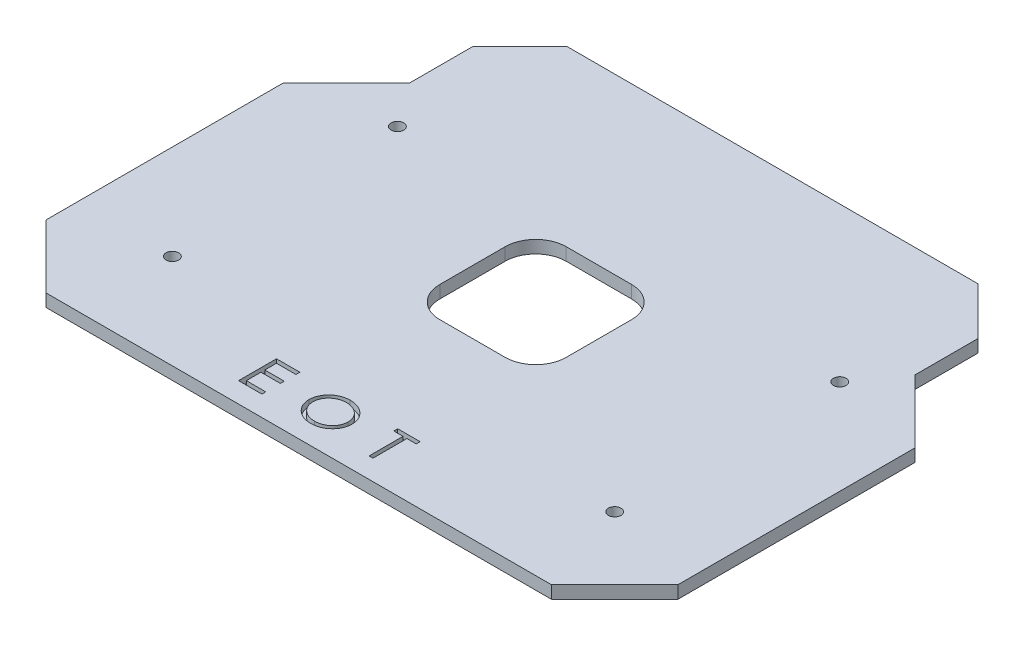
from build123d import *

# Parameters (mm, degrees)
SKETCH1_R           = 2
BOSS_EXTRUDE1_DEPTH = 4
CUT_EXTRUDE1_DEPTH  = 2


with BuildPart() as part:
    # Sketch1 → Boss-Extrude1 (new body)
    with BuildSketch(Plane(origin=(0, 0, 0), x_dir=(1, 0, 0), z_dir=(0, 1, 0))):
        Polygon((-80, 9.45742592), (-65, 24.45742592), (-25, 24.45742592), (25, 24.45742592), (65, 24.45742592), (80, 9.45742592), (80, -10.54257408), (100, -30.54257408), (100, -105.54257408), (80, -125.54257408), (-80, -125.54257408), (-100, -105.54257408), (-100, -30.54257408), (-80, -10.54257408), align=None)
        with Locations(Location((70, -24.316787178, 0), (0, 0, 270))):
            Circle(SKETCH1_R, mode=Mode.SUBTRACT)
        with Locations(Location((-70, -24.316787178, 0), (0, 0, 90))):
            Circle(SKETCH1_R, mode=Mode.SUBTRACT)
        with Locations(Location((70, -95.54257408, 0), (0, 0, 270))):
            Circle(SKETCH1_R, mode=Mode.SUBTRACT)
        with Locations(Location((-70, -95.54257408, 0), (0, 0, 90))):
            Circle(SKETCH1_R, mode=Mode.SUBTRACT)
        with BuildLine():
            Line((10.337598094, -30.54257408), (-10.337598094, -30.54257408))
            ThreePointArc((-10.337598094, -30.54257408), (-17.169948004, -33.372626076), (-20, -40.204975986))
            Line((-20, -40.204975986), (-20, -60.880172175))
            ThreePointArc((-20, -60.880172175), (-17.169948004, -67.712522085), (-10.337598094, -70.54257408))
            Line((-10.337598094, -70.54257408), (10.337598094, -70.54257408))
            ThreePointArc((10.337598094, -70.54257408), (17.169948004, -67.712522085), (20, -60.880172175))
            Line((20, -60.880172175), (20, -40.204975986))
            ThreePointArc((20, -40.204975986), (17.169948004, -33.372626076), (10.337598094, -30.54257408))
        make_face(mode=Mode.SUBTRACT)
    extrude(amount=BOSS_EXTRUDE1_DEPTH)

    # Sketch2 → Cut-Extrude1 (cut)
    # profile 1 of 3: a face of its own
    with BuildSketch(Plane(origin=(0, 4, 0), x_dir=(1, 0, 0), z_dir=(0, 1, 0))):
        Polygon((-25.472812288, -107.11733973), (-18.088196904, -107.11733973), (-18.088196904, -108.348108961), (-24.242043057, -108.348108961), (-24.242043057, -112.040416653), (-18.088196904, -112.040416653), (-18.088196904, -113.271185884), (-24.242043057, -113.271185884), (-24.242043057, -117.886570499), (-18.088196904, -117.886570499), (-18.088196904, -119.11733973), (-25.472812288, -119.11733973), align=None)
    # profile 2 of 3: a face of its own
    with BuildSketch(Plane(origin=(0, 4, 0), x_dir=(1, 0, 0), z_dir=(0, 1, 0))):
        with BuildLine():
            add(Edge.make_bspline(
                [(-2.449254596, -106.809647422), (-2.210250294, -106.815291388), (-1.741137338, -106.826369254), (-1.052600103, -106.910458186), (-0.39562656, -107.057401058), (0.234998612, -107.251617707), (0.833013231, -107.511533008), (1.401913508, -107.825392722), (1.940223039, -108.19794914), (2.443138546, -108.623167189), (2.901482907, -109.087804066), (3.30556983, -109.582626329), (3.641608313, -110.107938076), (3.925601094, -110.655428552), (4.137939972, -111.233761906), (4.293457565, -111.836588501), (4.386018721, -112.46623686), (4.398023561, -112.895080616), (4.404110789, -113.112532038)],
                knots=[0, 0, 0, 0, 1.104339174, 2.167575275, 3.19895946, 4.211974237, 5.212103104, 6.206540156, 7.210035823, 8.232212855, 9.245525355, 10.222267028, 11.178495095, 12.122427609, 13.066774007, 14.018748382, 14.995377748, 16, 16, 16, 16], degree=3))
            add(Edge.make_bspline(
                [(4.404110789, -113.112532038), (4.398050369, -113.328392066), (4.386099229, -113.754067761), (4.293053577, -114.379582401), (4.138376677, -114.979542971), (3.923642546, -115.555449046), (3.645900791, -116.106283535), (3.303525105, -116.630032235), (2.902767408, -117.129340391), (2.445660949, -117.597050461), (1.945808283, -118.023324325), (1.413543804, -118.399049089), (0.854948848, -118.718415341), (0.266006362, -118.975934066), (-0.347638297, -119.179500527), (-0.989897569, -119.319540684), (-1.657446562, -119.409328528), (-2.112422229, -119.419742975), (-2.343485365, -119.425032038)],
                knots=[0, 0, 0, 0, 1.006897034, 1.98559964, 2.943186421, 3.893189035, 4.847917768, 5.815452073, 6.80748931, 7.830684368, 8.862341799, 9.868509738, 10.866468422, 11.859160648, 12.862936224, 13.87796334, 14.922306222, 16, 16, 16, 16], degree=3))
            add(Edge.make_bspline(
                [(-2.343485365, -119.425032038), (-2.576950096, -119.419751502), (-3.036711209, -119.409352567), (-3.71220671, -119.319311427), (-4.360699664, -119.179942779), (-4.980525124, -118.978602698), (-5.5723218, -118.720276019), (-6.137109172, -118.40432461), (-6.672334655, -118.029426015), (-7.173565891, -117.603625551), (-7.631923667, -117.139805588), (-8.034841868, -116.645043071), (-8.372094355, -116.1233088), (-8.651102104, -115.57930445), (-8.869213941, -115.011416487), (-9.022819268, -114.418815701), (-9.116441893, -113.80221707), (-9.128324324, -113.382893249), (-9.13435075, -113.170224345)],
                knots=[0, 0, 0, 0, 1.090007837, 2.146547848, 3.177224824, 4.18441606, 5.184972819, 6.188625542, 7.201944888, 8.232227685, 9.256408654, 10.243626549, 11.2069681, 12.152656664, 13.094449289, 14.042142631, 15.007031417, 16, 16, 16, 16], degree=3))
            add(Edge.make_bspline(
                [(-9.13435075, -113.170224345), (-9.131402402, -113.027503498), (-9.125543406, -112.743886726), (-9.083913012, -112.322131275), (-9.014460276, -111.907586661), (-8.915300454, -111.501446595), (-8.79027069, -111.102737582), (-8.635770803, -110.712430579), (-8.452859537, -110.330424135), (-8.243335129, -109.958340787), (-8.012332045, -109.598947931), (-7.756068538, -109.258983468), (-7.479948492, -108.939194203), (-7.182889634, -108.640362727), (-6.867359525, -108.360919774), (-6.532033375, -108.100372257), (-6.176100518, -107.859172902), (-5.798893902, -107.642516339), (-5.409943928, -107.444915382), (-5.008890938, -107.277563759), (-4.602546124, -107.132145303), (-4.1874152, -107.014075594), (-3.764227753, -106.922537912), (-3.332923423, -106.859004422), (-2.894073915, -106.815043973), (-2.598402752, -106.811456889), (-2.449254596, -106.809647422)],
                knots=[0, 0, 0, 0, 1.000860702, 1.988923732, 2.969140983, 3.946405888, 4.918600368, 5.897447419, 6.887793071, 7.886663957, 8.890501988, 9.881803818, 10.869866848, 11.851371953, 12.834677219, 13.823874237, 14.827633617, 15.847405218, 16.872782081, 17.885187697, 18.892981817, 19.898014594, 20.909858577, 21.927149733, 22.954372848, 24, 24, 24, 24], degree=3))
        make_face()
        with BuildLine():
            add(Edge.make_bspline(
                [(-2.391562288, -108.040416653), (-2.51184609, -108.0418057), (-2.751297347, -108.044570903), (-3.107479041, -108.08096615), (-3.459211644, -108.132822075), (-3.806556963, -108.206786881), (-4.14828776, -108.307535093), (-4.487080949, -108.423686022), (-4.820001205, -108.564158934), (-5.145048651, -108.725339097), (-5.461327271, -108.900684803), (-5.759556253, -109.095930039), (-6.039502965, -109.306760329), (-6.304261521, -109.529097242), (-6.549973838, -109.767761164), (-6.777377431, -110.021526333), (-6.986073395, -110.291257805), (-7.178028363, -110.573366758), (-7.348947973, -110.867432361), (-7.498868436, -111.170494536), (-7.62377932, -111.483313645), (-7.724554049, -111.80421787), (-7.804316815, -112.132626352), (-7.862174528, -112.469031549), (-7.896221771, -112.814553211), (-7.901109212, -113.047553648), (-7.903581519, -113.165416653)],
                knots=[0, 0, 0, 0, 1.034314358, 2.059029303, 3.076765405, 4.092094375, 5.110880351, 6.139806059, 7.171636845, 8.216667878, 9.259764826, 10.280693852, 11.280175756, 12.273075775, 13.252873351, 14.224294354, 15.201858716, 16.184537379, 17.157522275, 18.125488912, 19.09060439, 20.051995777, 21.016643451, 21.995737629, 22.98614617, 24, 24, 24, 24], degree=3))
            add(Edge.make_bspline(
                [(-7.903581519, -113.165416653), (-7.898210266, -113.338737702), (-7.887640897, -113.679793001), (-7.812726489, -114.180904838), (-7.683291296, -114.659574953), (-7.508287161, -115.120354866), (-7.277404332, -115.558281175), (-7.000063223, -115.978132576), (-6.666845655, -116.372061943), (-6.292646829, -116.745390197), (-5.880146385, -117.082729501), (-5.44364821, -117.380106417), (-4.986383542, -117.633010709), (-4.506209078, -117.835958031), (-4.007433542, -117.999585026), (-3.486730857, -118.110234502), (-2.946554931, -118.18376774), (-2.578511943, -118.190727536), (-2.391562288, -118.194262807)],
                knots=[0, 0, 0, 0, 1.001985766, 1.97167371, 2.92126608, 3.864235468, 4.815363556, 5.777764185, 6.767768529, 7.793129838, 8.830022713, 9.843858898, 10.843270901, 11.845781331, 12.853757634, 13.873335827, 14.919748107, 16, 16, 16, 16], degree=3))
            add(Edge.make_bspline(
                [(-2.391562288, -118.194262807), (-2.265694924, -118.192621379), (-2.015966383, -118.189364685), (-1.645104851, -118.157003325), (-1.281395782, -118.104598333), (-0.925240361, -118.029433653), (-0.576244711, -117.935364332), (-0.233153423, -117.823551486), (0.100372074, -117.684715343), (0.427101168, -117.529966058), (0.740175644, -117.354340251), (1.039601812, -117.16560959), (1.318510615, -116.957318496), (1.581165171, -116.736781999), (1.825472925, -116.499862953), (2.050952736, -116.246848151), (2.261725563, -115.980033401), (2.450260234, -115.696029586), (2.621177719, -115.402100516), (2.767700537, -115.097816084), (2.893598008, -114.786452751), (2.997130868, -114.466920991), (3.076803707, -114.139077256), (3.1313758, -113.803085971), (3.16606526, -113.45941233), (3.170902759, -113.22719785), (3.173341558, -113.110128191)],
                knots=[0, 0, 0, 0, 1.078057494, 2.138931934, 3.186396846, 4.224372019, 5.255081129, 6.281828204, 7.313085757, 8.34778727, 9.37721554, 10.386466275, 11.377698063, 12.356805186, 13.322831121, 14.290221845, 15.258318578, 16.233084811, 17.207971885, 18.168911637, 19.123652981, 20.083145109, 21.043790605, 22.010913397, 22.997212883, 24, 24, 24, 24], degree=3))
            add(Edge.make_bspline(
                [(3.173341558, -113.110128191), (3.17090158, -112.993859656), (3.166061946, -112.763244051), (3.131393694, -112.421962658), (3.076744617, -112.088390211), (2.99751732, -111.763602521), (2.893538851, -111.448182118), (2.767688648, -111.141603013), (2.62108354, -110.842157029), (2.450347273, -110.552897813), (2.260835592, -110.2736522), (2.051169953, -110.008485876), (1.822036233, -109.758928429), (1.576327544, -109.520966037), (1.3089803, -109.302162037), (1.02661365, -109.09253243), (0.723417639, -108.901791872), (0.404825644, -108.724478005), (0.075233739, -108.564179625), (-0.261824464, -108.424238717), (-0.604923371, -108.306558799), (-0.951912321, -108.207281647), (-1.305443018, -108.132458501), (-1.662879889, -108.081207676), (-2.025417117, -108.044452246), (-2.268872505, -108.04176892), (-2.391562288, -108.040416653)],
                knots=[0, 0, 0, 0, 0.999618921, 1.982718035, 2.946629433, 3.904142108, 4.854089328, 5.799603779, 6.751722253, 7.718313886, 8.685273778, 9.65154614, 10.6220342, 11.596597958, 12.589904812, 13.590354425, 14.618671442, 15.667306976, 16.72423902, 17.768315198, 18.803281207, 19.841475733, 20.86981583, 21.90753015, 22.945496034, 24, 24, 24, 24], degree=3))
        make_face(mode=Mode.SUBTRACT)
    # profile 3 of 3: a face of its own
    with BuildSketch(Plane(origin=(0, 4, 0), x_dir=(1, 0, 0), z_dir=(0, 1, 0))):
        Polygon((12.896418481, -108.348108961), (12.896418481, -107.11733973), (19.973341558, -107.11733973), (19.973341558, -108.348108961), (17.050264635, -108.348108961), (17.050264635, -119.11733973), (15.819495404, -119.11733973), (15.819495404, -108.348108961), align=None)
    extrude(amount=-CUT_EXTRUDE1_DEPTH, mode=Mode.SUBTRACT)


solid = part.part
